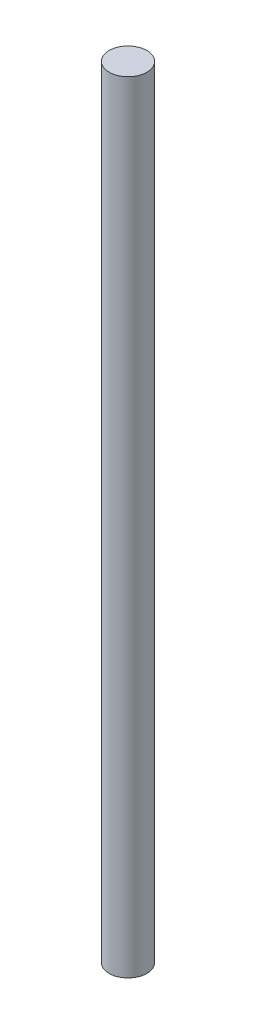
from build123d import *

# Parameters (mm, degrees)
SKETCH1_R           = 88.9
BOSS_EXTRUDE1_DEPTH = 3683


with BuildPart() as part:
    # Sketch1 → Boss-Extrude1 (new body)
    with BuildSketch(Plane(origin=(0, 0, 0), x_dir=(1, 0, 0), z_dir=(0, 1, 0))):
        with Locations(Location((0, 0, 0), (0, 0, 90))):
            Circle(SKETCH1_R)
    extrude(amount=BOSS_EXTRUDE1_DEPTH)


solid = part.part
